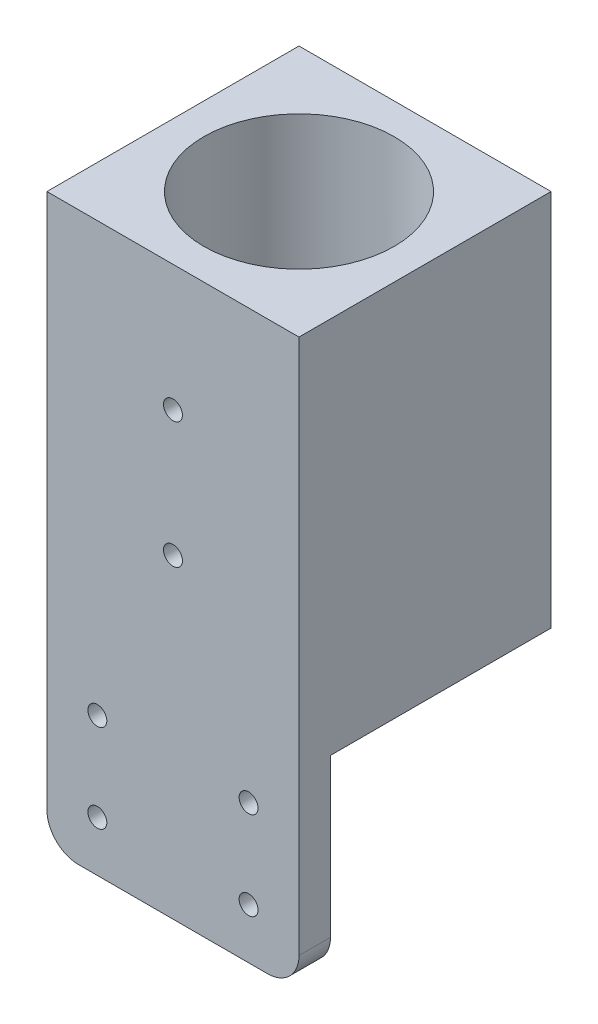
from build123d import *

# Parameters (mm, degrees)
SKETCH_1_W             = 40
SKETCH_1_H             = 40
EXTRUDE_1_DEPTH        = 60
SKETCH_2_R             = 15.1
CUT_EXTRUDE_1_DEPTH    = 50
SKETCH_3_W             = 40
SKETCH_3_H             = 30
SKETCH_3_R             = 1.5
EXTRUDE_2_DEPTH        = 5
FILLET_1_R             = 5
SKETCH_4_R             = 1.5
CUT_EXTRUDE_2_DEPTH    = 75.833147735
PATTERN_LINEAR_1_COUNT = 2
PATTERN_LINEAR_1_PITCH = 20


with BuildPart() as part:
    # 草圖1 → 填料-伸長1 (new body)
    with BuildSketch(Plane(origin=(0, 0, 0), x_dir=(1, 0, 0), z_dir=(0, 1, 0))):
        Rectangle(SKETCH_1_W, SKETCH_1_H)
    extrude(amount=EXTRUDE_1_DEPTH)

    # 草圖2 → 除料-伸長1 (cut)
    with BuildSketch(Plane(origin=(0, 60, 0), x_dir=(1, 0, 0), z_dir=(0, 1, 0))):
        with Locations(Location((0, 0, 0), (0, 0, 270))):
            Circle(SKETCH_2_R)
    extrude(amount=-CUT_EXTRUDE_1_DEPTH, mode=Mode.SUBTRACT)

    # 草圖3 → 填料-伸長2 (add)
    with BuildSketch(Plane.XY.offset(20)):
        with Locations((0, -15)):
            Rectangle(SKETCH_3_W, SKETCH_3_H)
        with Locations((-12, -8)):
            Circle(SKETCH_3_R, mode=Mode.SUBTRACT)
        with Locations((-12, -22)):
            Circle(SKETCH_3_R, mode=Mode.SUBTRACT)
        with Locations(Location((12, -22, 0), (0, 0, 180))):
            Circle(SKETCH_3_R, mode=Mode.SUBTRACT)
        with Locations(Location((12, -8, 0), (0, 0, 180))):
            Circle(SKETCH_3_R, mode=Mode.SUBTRACT)
    extrude(amount=-EXTRUDE_2_DEPTH)

    # 圓角1
    fillet_1_edges = [part.edges().sort_by_distance(p)[0] for p in [
        (-20, -30, 17.5),
        (20, -30, 17.5),
    ]]
    fillet(fillet_1_edges, radius=FILLET_1_R)

    # 草圖4 → 除料-伸長2 (cut, through all)
    with BuildSketch(Plane(origin=(0, 0, -20), x_dir=(-1, 0, 0), z_dir=(0, 0, -1))):
        with Locations((0, 20)):
            Circle(SKETCH_4_R)
    cut_extrude_2 = extrude(amount=-CUT_EXTRUDE_2_DEPTH, mode=Mode.SUBTRACT)

    # 直線複製排列1: 除料-伸長2 ×2
    with Locations(*[(0, i * PATTERN_LINEAR_1_PITCH, 0) for i in range(1, PATTERN_LINEAR_1_COUNT)]):
        add(cut_extrude_2, mode=Mode.SUBTRACT)


solid = part.part
